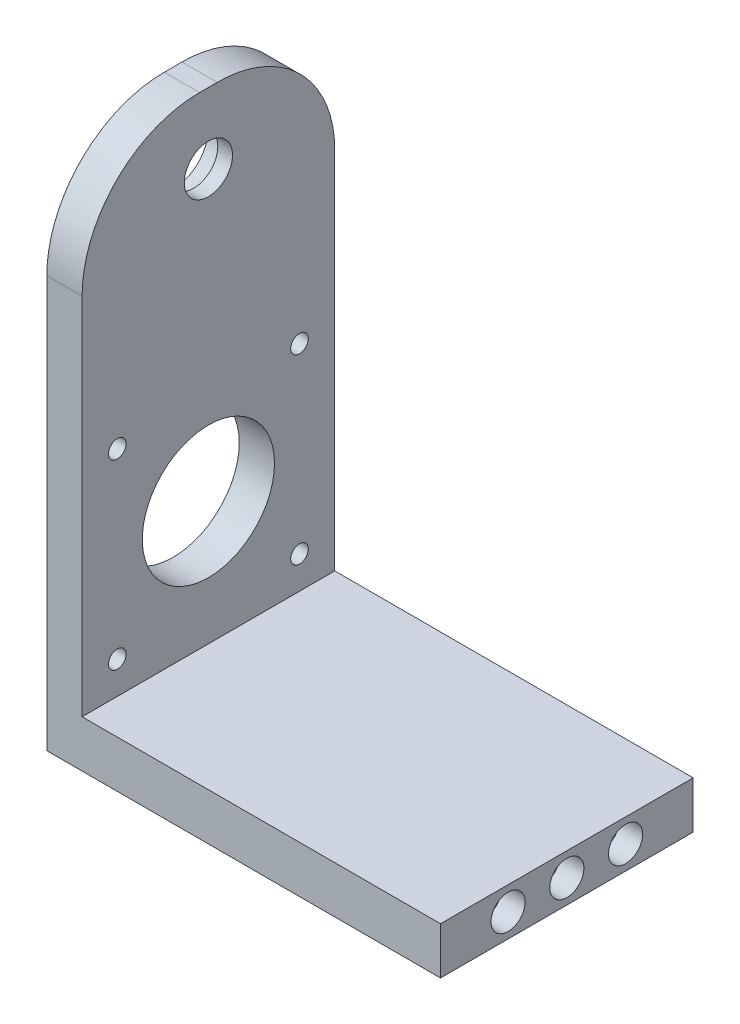
from build123d import *

# Parameters (mm, degrees)
SKETCH1_W           = 67
SKETCH1_H           = 43
BOSS_EXTRUDE1_DEPTH = 8
SKETCH2_W           = 6
SKETCH2_H           = 43
BOSS_EXTRUDE2_DEPTH = 82
CUT_EXTRUDE1_REACH  = 112.83
SKETCH3_R           = 11.25
SKETCH3_R_2         = 1.5
CUT_EXTRUDE2_REACH  = 112.83
SKETCH4_R           = 4.1
FILLET1_R           = 20
SKETCH6_R           = 2.9
CUT_EXTRUDE4_DEPTH  = 4
SKETCH7_R           = 6
CUT_EXTRUDE5_DEPTH  = 3.5
CUT_EXTRUDE6_START  = -8
SKETCH8_R           = 16
CUT_EXTRUDE6_DEPTH  = 3.5
SKETCH9_R           = 2.9
CUT_EXTRUDE7_DEPTH  = 4


with BuildPart() as part:
    # Sketch1 → Boss-Extrude1 (new body)
    with BuildSketch(Plane(origin=(0, 0, 0), x_dir=(1, 0, 0), z_dir=(0, 1, 0))):
        Rectangle(SKETCH1_W, SKETCH1_H)
    extrude(amount=BOSS_EXTRUDE1_DEPTH)

    # Sketch2 → Boss-Extrude2 (add)
    with BuildSketch(Plane(origin=(0, 8, 0), x_dir=(1, 0, 0), z_dir=(0, 1, 0))):
        with Locations((-30.5, 0)):
            Rectangle(SKETCH2_W, SKETCH2_H)
    extrude(amount=BOSS_EXTRUDE2_DEPTH)

    # Sketch3 → Cut-Extrude1 (cut, up to next)
    with BuildSketch(Plane(origin=(-27.5, 0, 0), x_dir=(0, 0, -1), z_dir=(1, 0, 0)), mode=Mode.PRIVATE) as cut_extrude1_sk1:
        with Locations((0, 29)):
            Circle(SKETCH3_R)
    cut_extrude1_tool1 = extrude(cut_extrude1_sk1.sketch, amount=-CUT_EXTRUDE1_REACH, mode=Mode.PRIVATE) & part.part
    # Sketch3 → Cut-Extrude1 (cut, up to next)
    with BuildSketch(Plane(origin=(-27.5, 0, 0), x_dir=(0, 0, -1), z_dir=(1, 0, 0)), mode=Mode.PRIVATE) as cut_extrude1_sk2:
        with Locations((-15.5, 44.5)):
            Circle(SKETCH3_R_2)
    cut_extrude1_tool2 = extrude(cut_extrude1_sk2.sketch, amount=-CUT_EXTRUDE1_REACH, mode=Mode.PRIVATE) & part.part
    # Sketch3 → Cut-Extrude1 (cut, up to next)
    with BuildSketch(Plane(origin=(-27.5, 0, 0), x_dir=(0, 0, -1), z_dir=(1, 0, 0)), mode=Mode.PRIVATE) as cut_extrude1_sk3:
        with Locations((15.5, 44.5)):
            Circle(SKETCH3_R_2)
    cut_extrude1_tool3 = extrude(cut_extrude1_sk3.sketch, amount=-CUT_EXTRUDE1_REACH, mode=Mode.PRIVATE) & part.part
    # Sketch3 → Cut-Extrude1 (cut, up to next)
    with BuildSketch(Plane(origin=(-27.5, 0, 0), x_dir=(0, 0, -1), z_dir=(1, 0, 0)), mode=Mode.PRIVATE) as cut_extrude1_sk4:
        with Locations((15.5, 13.5)):
            Circle(SKETCH3_R_2)
    cut_extrude1_tool4 = extrude(cut_extrude1_sk4.sketch, amount=-CUT_EXTRUDE1_REACH, mode=Mode.PRIVATE) & part.part
    # Sketch3 → Cut-Extrude1 (cut, up to next)
    with BuildSketch(Plane(origin=(-27.5, 0, 0), x_dir=(0, 0, -1), z_dir=(1, 0, 0)), mode=Mode.PRIVATE) as cut_extrude1_sk5:
        with Locations((-15.5, 13.5)):
            Circle(SKETCH3_R_2)
    cut_extrude1_tool5 = extrude(cut_extrude1_sk5.sketch, amount=-CUT_EXTRUDE1_REACH, mode=Mode.PRIVATE) & part.part
    add(cut_extrude1_tool1.solids().sort_by_distance((-27.5, 29, 0))[0], mode=Mode.SUBTRACT)
    add(cut_extrude1_tool2.solids().sort_by_distance((-27.5, 44.5, 15.5))[0], mode=Mode.SUBTRACT)
    add(cut_extrude1_tool3.solids().sort_by_distance((-27.5, 44.5, -15.5))[0], mode=Mode.SUBTRACT)
    add(cut_extrude1_tool4.solids().sort_by_distance((-27.5, 13.5, -15.5))[0], mode=Mode.SUBTRACT)
    add(cut_extrude1_tool5.solids().sort_by_distance((-27.5, 13.5, 15.5))[0], mode=Mode.SUBTRACT)

    # Sketch4 → Cut-Extrude2 (cut, up to next)
    with BuildSketch(Plane(origin=(-27.5, 0, 0), x_dir=(0, 0, -1), z_dir=(1, 0, 0)), mode=Mode.PRIVATE) as cut_extrude2_sk1:
        with Locations((0, 78)):
            Circle(SKETCH4_R)
    cut_extrude2_tool1 = extrude(cut_extrude2_sk1.sketch, amount=-CUT_EXTRUDE2_REACH, mode=Mode.PRIVATE) & part.part
    add(cut_extrude2_tool1.solids().sort_by_distance((-27.5, 78, 0))[0], mode=Mode.SUBTRACT)

    # Fillet1
    fillet1_edges = [part.edges().sort_by_distance(p)[0] for p in [
        (-30.5, 90, -21.5),
        (-30.5, 90, 21.5),
    ]]
    fillet(fillet1_edges, radius=FILLET1_R)

    # Sketch6 → Cut-Extrude4 (cut)
    with BuildSketch(Plane(origin=(33.5, 0, 0), x_dir=(0, 0, -1), z_dir=(1, 0, 0))):
        with Locations((0, 4)):
            Circle(SKETCH6_R)
        with Locations((10, 4)):
            Circle(SKETCH6_R)
        with Locations((-10, 4)):
            Circle(SKETCH6_R)
    extrude(amount=-CUT_EXTRUDE4_DEPTH, mode=Mode.SUBTRACT)

    # Sketch7 → Cut-Extrude5 (cut)
    with BuildSketch(Plane.ZY.offset(33.5)):
        with Locations((0, 78)):
            Circle(SKETCH7_R)
    extrude(amount=-CUT_EXTRUDE5_DEPTH, mode=Mode.SUBTRACT)

    # Sketch8 → Cut-Extrude6 (cut)
    with BuildSketch(Plane(origin=(0, 8, 0), x_dir=(1, 0, 0), z_dir=(0, 1, 0)).offset(CUT_EXTRUDE6_START)):
        with Locations(Location((3, 0, 0), (0, 0, 270))):
            Circle(SKETCH8_R)
    extrude(amount=CUT_EXTRUDE6_DEPTH, mode=Mode.SUBTRACT)

    # Sketch9 → Cut-Extrude7 (cut)
    with BuildSketch(Plane.XZ.offset(-3.5)):
        with Locations(Location((3, 12, 0), (0, 0, 270))):
            Circle(SKETCH9_R)
        with Locations(Location((15, 0, 0), (0, 0, 270))):
            Circle(SKETCH9_R)
        with Locations(Location((3, -12, 0), (0, 0, 270))):
            Circle(SKETCH9_R)
        with Locations(Location((-9, 0, 0), (0, 0, 270))):
            Circle(SKETCH9_R)
    extrude(amount=-CUT_EXTRUDE7_DEPTH, mode=Mode.SUBTRACT)


solid = part.part
